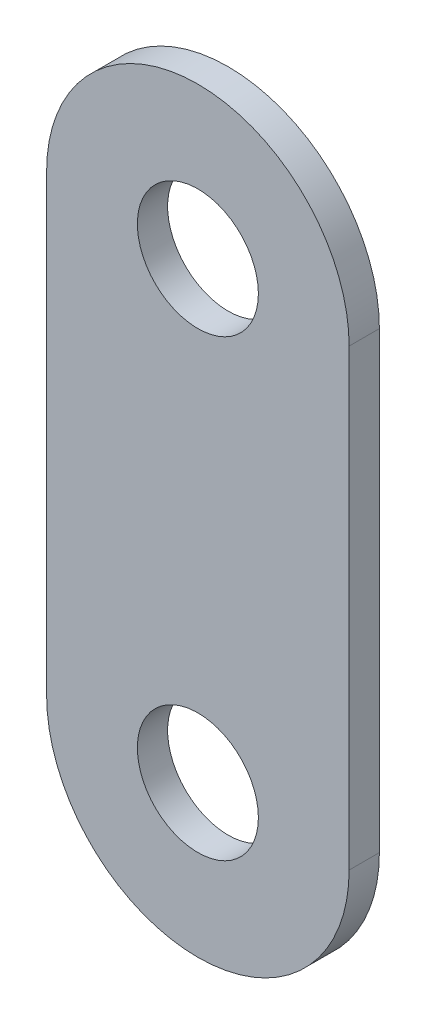
from build123d import *

# Parameters (mm, degrees)
SKETCH1_R           = 10
BOSS_EXTRUDE1_DEPTH = 5


with BuildPart() as part:
    # Sketch1 → Boss-Extrude1 (new body)
    with BuildSketch(Plane.XY):
        with BuildLine():
            Line((0, 50), (0, 125))
            ThreePointArc((0, 125), (25, 150), (50, 125))
            Line((50, 125), (50, 50))
            ThreePointArc((50, 50), (25, 25), (0, 50))
        make_face()
        with Locations((25, 50)):
            Circle(SKETCH1_R, mode=Mode.SUBTRACT)
        with Locations((25, 125)):
            Circle(SKETCH1_R, mode=Mode.SUBTRACT)
    extrude(amount=BOSS_EXTRUDE1_DEPTH)


solid = part.part
